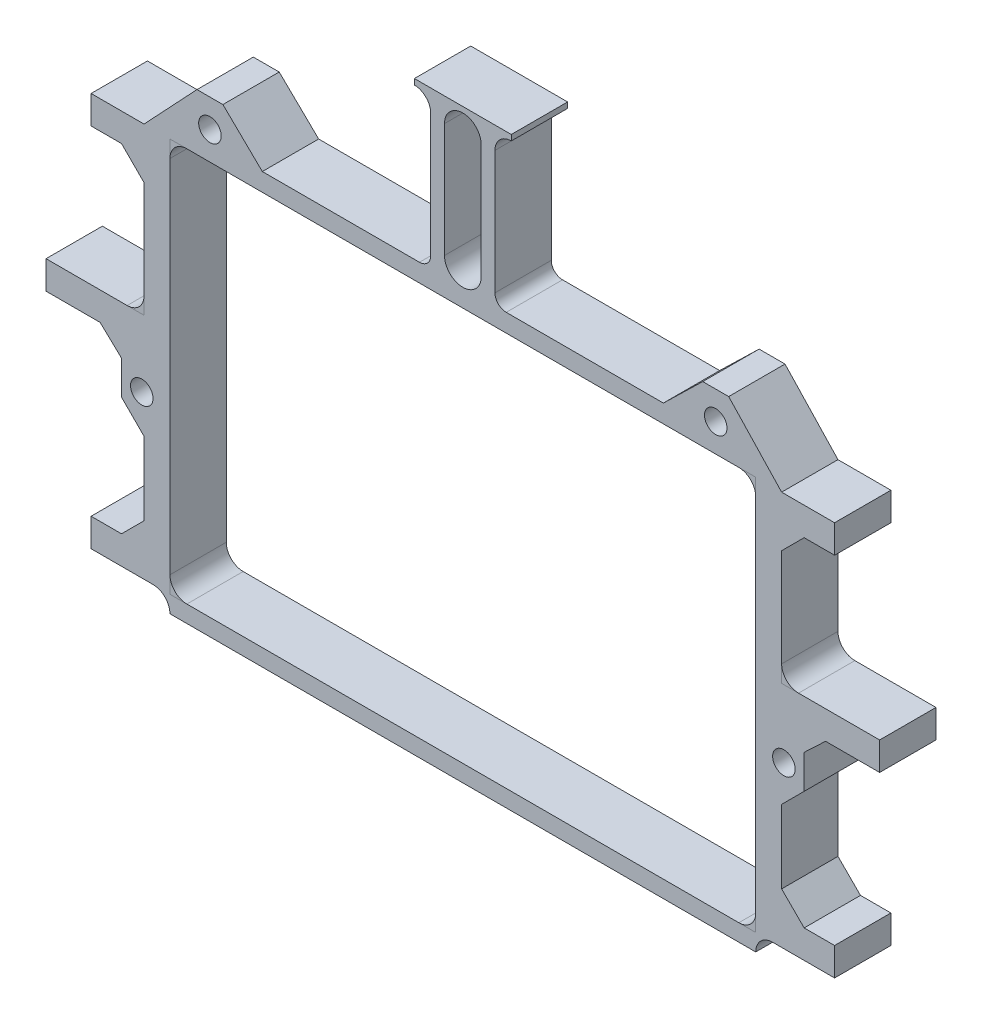
from build123d import *

# Parameters (mm, degrees)
CROQUIS1_W                = 74
CROQUIS1_H                = 52
SALIENTE_EXTRUIR1_DEPTH   = 5
CROQUIS2_W                = 52
CROQUIS2_H                = 35
CORTAR_EXTRUIR1_DEPTH     = 5
CROQUIS3_R                = 1
CROQUIS3_R_2              = 1.45
CROQUIS3_R_3              = 1.63
CORTAR_EXTRUIR2_DEPTH     = 5
SALIENTE_EXTRUIR2_DEPTH   = 5
SALIENTE_EXTRUIR2_2_DEPTH = 5
SALIENTE_EXTRUIR2_3_DEPTH = 5
SALIENTE_EXTRUIR2_4_DEPTH = 5
SALIENTE_EXTRUIR2_5_DEPTH = 5
SALIENTE_EXTRUIR2_6_DEPTH = 5


with BuildPart() as part:
    # Croquis1 → Saliente-Extruir1 (new body)
    with BuildSketch(Plane.XY):
        Rectangle(CROQUIS1_W, CROQUIS1_H)
    extrude(amount=SALIENTE_EXTRUIR1_DEPTH)

    # Croquis2 → Cortar-Extruir1 (cut)
    with BuildSketch(Plane.XY.offset(5)):
        with Locations((0, -7)):
            Rectangle(CROQUIS2_W, CROQUIS2_H)
    extrude(amount=-CORTAR_EXTRUIR1_DEPTH, mode=Mode.SUBTRACT)

    # Croquis3 → Cortar-Extruir2 (cut)
    with BuildSketch(Plane.XY.offset(5)):
        with BuildLine():
            Line((33, -22), (33, -24.5))
            Line((33, -24.5), (27.5, -24.5))
            ThreePointArc((27.5, -24.5), (28.560660172, -24.939339828), (29, -26))
            Line((29, -26), (37, -26))
            Line((37, -26), (37, -6.7))
            Line((37, -6.7), (32.2, -6.7))
            Line((32.2, -6.7), (30.3, -8.5))
            Line((30.3, -8.5), (30.3, -11.5))
            Line((30.3, -11.5), (28.3, -13.5))
            Line((28.3, -13.5), (28.3, -20))
            Line((28.3, -20), (30.3, -22))
            Line((30.3, -22), (33, -22))
        make_face()
        with BuildLine():
            ThreePointArc((29, -26), (28.560660172, -24.939339828), (27.5, -24.5))
            ThreePointArc((27.5, -24.5), (26.439339828, -24.939339828), (26, -26))
            Line((26, -26), (29, -26))
        make_face()
        with BuildLine():
            ThreePointArc((26, -26), (27.5, -27.5), (29, -26))
            Line((29, -26), (26, -26))
        make_face()
        with BuildLine():
            Line((28.3, -4.2), (37, -4.2))
            Line((37, -4.2), (37, 26))
            Line((37, 26), (4.3, 26))
            Line((4.3, 26), (4.3, 25.5))
            ThreePointArc((4.3, 25.5), (5.325304833, 25.075304833), (5.75, 24.05))
            ThreePointArc((5.75, 24.05), (4.3, 22.6), (2.85, 24.05))
            Line((2.85, 24.05), (2.85, 13.1))
            ThreePointArc((2.85, 13.1), (3.85, 14.1), (4.85, 13.1))
            ThreePointArc((4.85, 13.1), (4.557106781, 12.392893219), (3.85, 12.1))
            Line((3.85, 12.1), (17.8, 12.1))
            Line((17.8, 12.1), (21.3, 15.5))
            Line((21.3, 15.5), (23.6, 15.5))
            Line((23.6, 15.5), (28.3, 10.5))
            Line((28.3, 10.5), (33, 10.5))
            Line((33, 10.5), (33, 8))
            Line((33, 8), (30.3, 8))
            Line((30.3, 8), (28.3, 6))
            Line((28.3, 6), (28.3, -4.2))
        make_face()
        with Locations((3.85, 13.1)):
            Circle(CROQUIS3_R)
        with Locations((4.3, 24.05)):
            Circle(CROQUIS3_R_2)
        with BuildLine():
            Line((0, 22.24), (0, 15.36))
            ThreePointArc((0, 15.36), (1.152584053, 14.882584053), (1.63, 13.73))
            Line((1.63, 13.73), (1.63, 23.87))
            ThreePointArc((1.63, 23.87), (1.152584053, 22.717415947), (0, 22.24))
        make_face()
        with Locations((0, 23.87)):
            Circle(CROQUIS3_R_3)
        with Locations((0, 13.73)):
            Circle(CROQUIS3_R_3)
        with Locations((22.45, 13)):
            Circle(CROQUIS3_R)
        with Locations((28.5, -10.2)):
            Circle(CROQUIS3_R)
    cortar_extruir2 = extrude(amount=-CORTAR_EXTRUIR2_DEPTH, mode=Mode.SUBTRACT)

    # Simetría2: Cortar-Extruir2 across plane
    add(cortar_extruir2.mirror(Plane.ZY), mode=Mode.SUBTRACT)


with BuildPart() as body_2:
    # Croquis4 → Saliente-Extruir2 (new body)
    with BuildSketch(Plane.XY.offset(5)):
        with BuildLine():
            ThreePointArc((-26, 9), (-25.560660172, 10.060660172), (-24.5, 10.5))
            Line((-24.5, 10.5), (-26, 10.5))
            Line((-26, 10.5), (-26, 9))
        make_face()
    extrude(amount=-SALIENTE_EXTRUIR2_DEPTH)


with BuildPart() as body_3:
    # Croquis4 → Saliente-Extruir2 2 (new body)
    with BuildSketch(Plane.XY.offset(5)):
        with BuildLine():
            Line((-29.8, -4.2), (-28.3, -4.2))
            Line((-28.3, -4.2), (-28.3, -2.7))
            ThreePointArc((-28.3, -2.7), (-28.739339828, -3.760660172), (-29.8, -4.2))
        make_face()
    extrude(amount=-SALIENTE_EXTRUIR2_2_DEPTH)


with BuildPart() as body_4:
    # Croquis4 → Saliente-Extruir2 3 (new body)
    with BuildSketch(Plane.XY.offset(5)):
        with BuildLine():
            ThreePointArc((-24.5, -24.5), (-25.560660178, -24.060660166), (-26, -22.999999983))
            Line((-26, -22.999999983), (-26, -24.5))
            Line((-26, -24.5), (-24.5, -24.5))
        make_face()
    extrude(amount=-SALIENTE_EXTRUIR2_3_DEPTH)


with BuildPart() as body_5:
    # Croquis4 → Saliente-Extruir2 4 (new body)
    with BuildSketch(Plane.XY.offset(5)):
        with BuildLine():
            Line((26, -24.5), (26, -23))
            ThreePointArc((26, -23), (25.560660172, -24.060660172), (24.5, -24.5))
            Line((24.5, -24.5), (26, -24.5))
        make_face()
    extrude(amount=-SALIENTE_EXTRUIR2_4_DEPTH)


with BuildPart() as body_6:
    # Croquis4 → Saliente-Extruir2 5 (new body)
    with BuildSketch(Plane.XY.offset(5)):
        with BuildLine():
            Line((28.3, -2.7), (28.3, -4.2))
            Line((28.3, -4.2), (29.8, -4.2))
            ThreePointArc((29.8, -4.2), (28.739339828, -3.760660172), (28.3, -2.7))
        make_face()
    extrude(amount=-SALIENTE_EXTRUIR2_5_DEPTH)


with BuildPart() as body_7:
    # Croquis4 → Saliente-Extruir2 6 (new body)
    with BuildSketch(Plane.XY.offset(5)):
        with BuildLine():
            Line((26, 9), (26, 10.5))
            Line((26, 10.5), (24.5, 10.5))
            ThreePointArc((24.5, 10.5), (25.560660172, 10.060660172), (26, 9))
        make_face()
    extrude(amount=-SALIENTE_EXTRUIR2_6_DEPTH)


solid = Compound([part.part, body_2.part, body_3.part, body_4.part, body_5.part, body_6.part, body_7.part])
